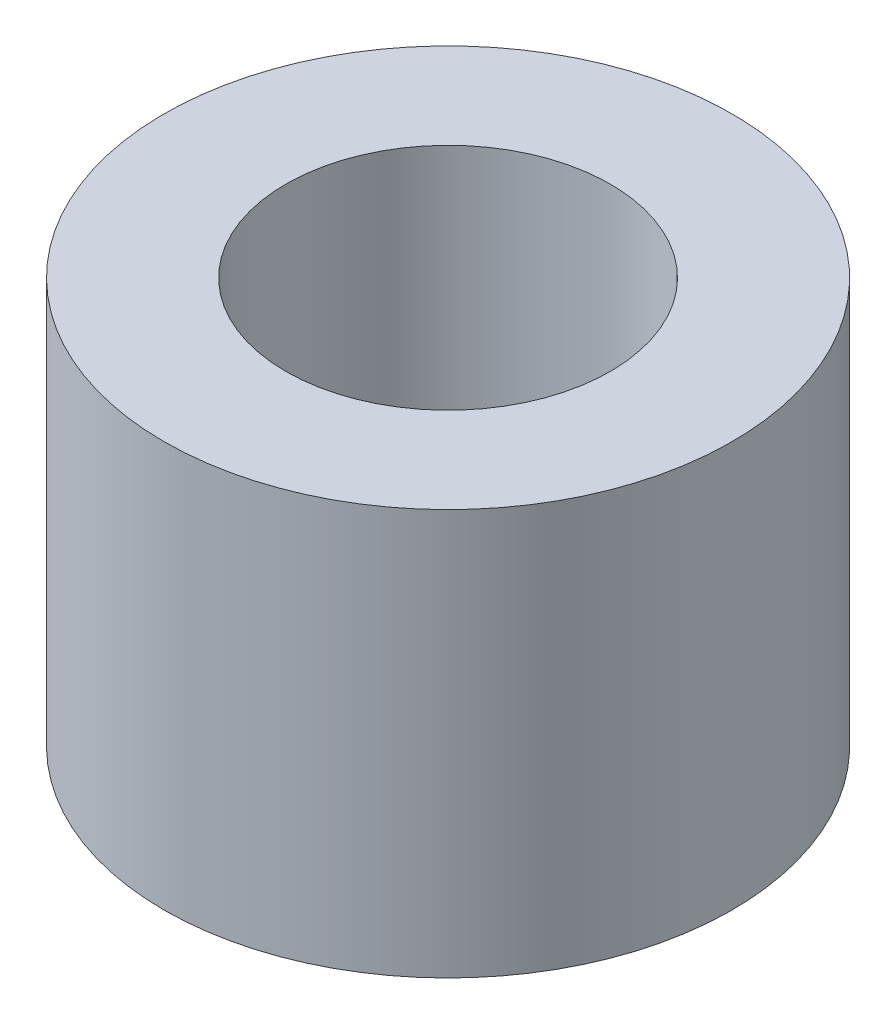
from build123d import *

# Parameters (mm, degrees)
SKETCH1_R           = 3.5
SKETCH1_R_2         = 2
BOSS_EXTRUDE1_DEPTH = 5


with BuildPart() as part:
    # Sketch1 → Boss-Extrude1 (new body)
    with BuildSketch(Plane(origin=(0, 0, 0), x_dir=(1, 0, 0), z_dir=(0, 1, 0))):
        with Locations(Location((0, 0, 0), (0, 0, 270))):
            Circle(SKETCH1_R)
        with Locations(Location((0, 0, 0), (0, 0, 270))):
            Circle(SKETCH1_R_2, mode=Mode.SUBTRACT)
    extrude(amount=BOSS_EXTRUDE1_DEPTH)


solid = part.part
